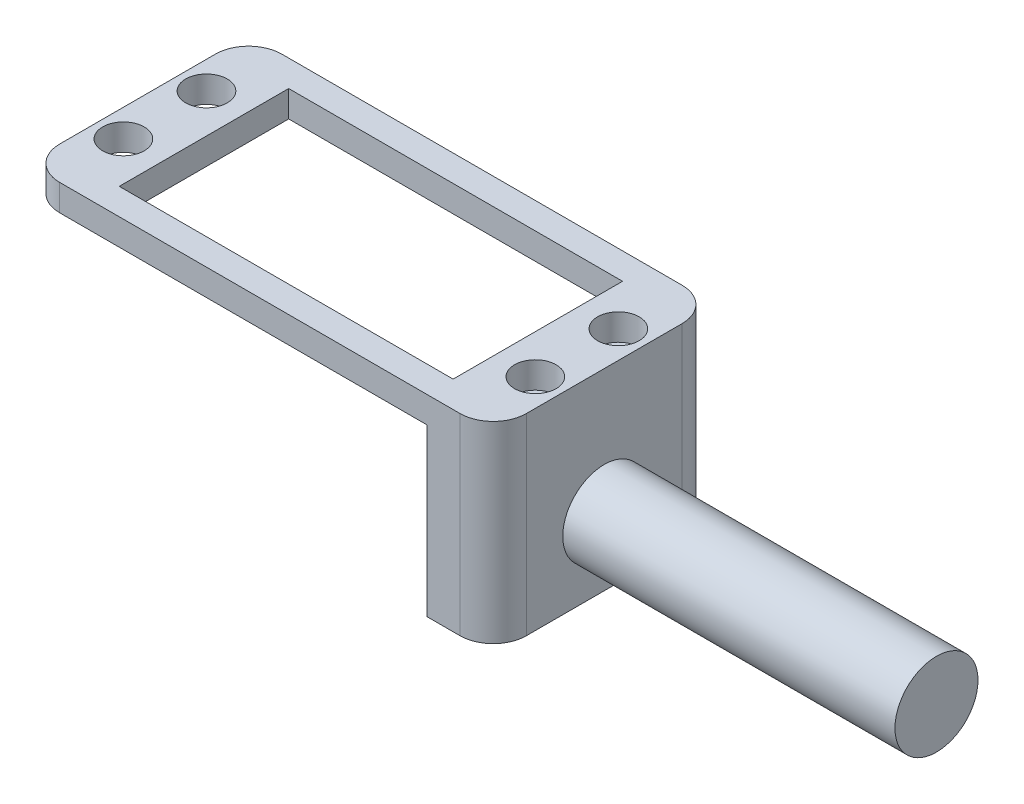
from build123d import *

# Parameters (mm, degrees)
SKETCH1_W           = 56.2
SKETCH1_H           = 26.75
SKETCH1_R           = 2.5
SKETCH1_W_2         = 40.2
SKETCH1_H_2         = 20.4
BOSS_EXTRUDE1_DEPTH = 3.175
SKETCH3_W           = 8
SKETCH3_H           = 26.75
BOSS_EXTRUDE2_DEPTH = 20
FILLET1_R           = 4
SKETCH4_R           = 5
BOSS_EXTRUDE3_DEPTH = 40


with BuildPart() as part:
    # Sketch1 → Boss-Extrude1 (new body)
    with BuildSketch(Plane(origin=(0, 0, 0), x_dir=(1, 0, 0), z_dir=(0, 1, 0))):
        Rectangle(SKETCH1_W, SKETCH1_H)
        with Locations(Location((24.8, 5, 0), (0, 0, 270))):
            Circle(SKETCH1_R, mode=Mode.SUBTRACT)
        with Locations(Location((24.8, -5, 0), (0, 0, 270))):
            Circle(SKETCH1_R, mode=Mode.SUBTRACT)
        with Locations(Location((-24.8, -5, 0), (0, 0, 90))):
            Circle(SKETCH1_R, mode=Mode.SUBTRACT)
        with Locations(Location((-24.8, 5, 0), (0, 0, 90))):
            Circle(SKETCH1_R, mode=Mode.SUBTRACT)
        Rectangle(SKETCH1_W_2, SKETCH1_H_2, mode=Mode.SUBTRACT)
    extrude(amount=BOSS_EXTRUDE1_DEPTH)

    # Sketch3 → Boss-Extrude2 (add)
    with BuildSketch(Plane.XZ):
        with Locations((24.1, 0)):
            Rectangle(SKETCH3_W, SKETCH3_H)
    extrude(amount=BOSS_EXTRUDE2_DEPTH)

    # Fillet1
    fillet1_edges = [part.edges().sort_by_distance(p)[0] for p in [
        (28.1, -8.4125, 13.375),
        (-28.1, 1.5875, 13.375),
        (-28.1, 1.5875, -13.375),
        (28.1, -8.4125, -13.375),
    ]]
    fillet(fillet1_edges, radius=FILLET1_R)

    # Sketch4 → Boss-Extrude3 (add)
    with BuildSketch(Plane(origin=(28.1, 0, 0), x_dir=(0, 0, -1), z_dir=(1, 0, 0))):
        with Locations(Location((0, -11.825, 0), (0, 0, 180))):
            Circle(SKETCH4_R)
    extrude(amount=BOSS_EXTRUDE3_DEPTH)


solid = part.part
